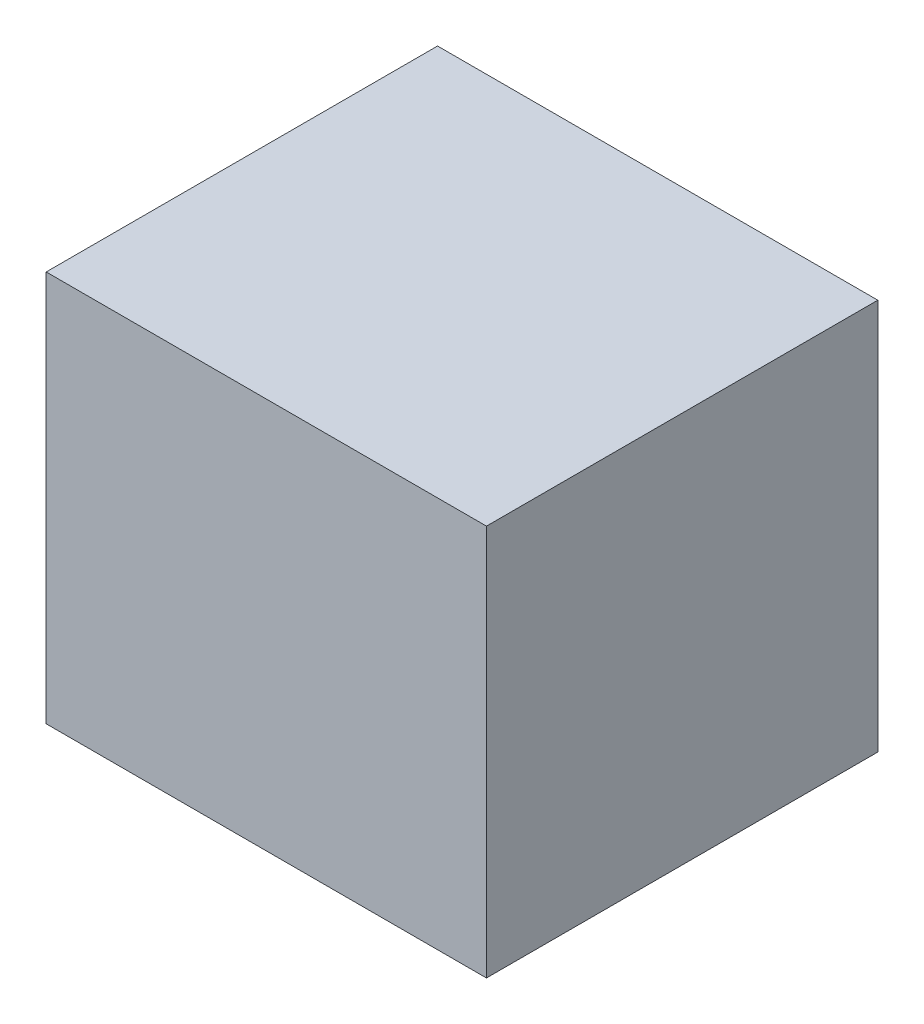
from build123d import *

# Parameters (mm, degrees)
SKETCH1_W          = 57.15
SKETCH1_H          = 50.8
BASE_EXTRUDE_DEPTH = 50.8


with BuildPart() as part:
    # Sketch1 → Base-Extrude (new body)
    with BuildSketch(Plane.XY):
        with Locations((28.575, 25.4)):
            Rectangle(SKETCH1_W, SKETCH1_H)
    extrude(amount=BASE_EXTRUDE_DEPTH)


solid = part.part
